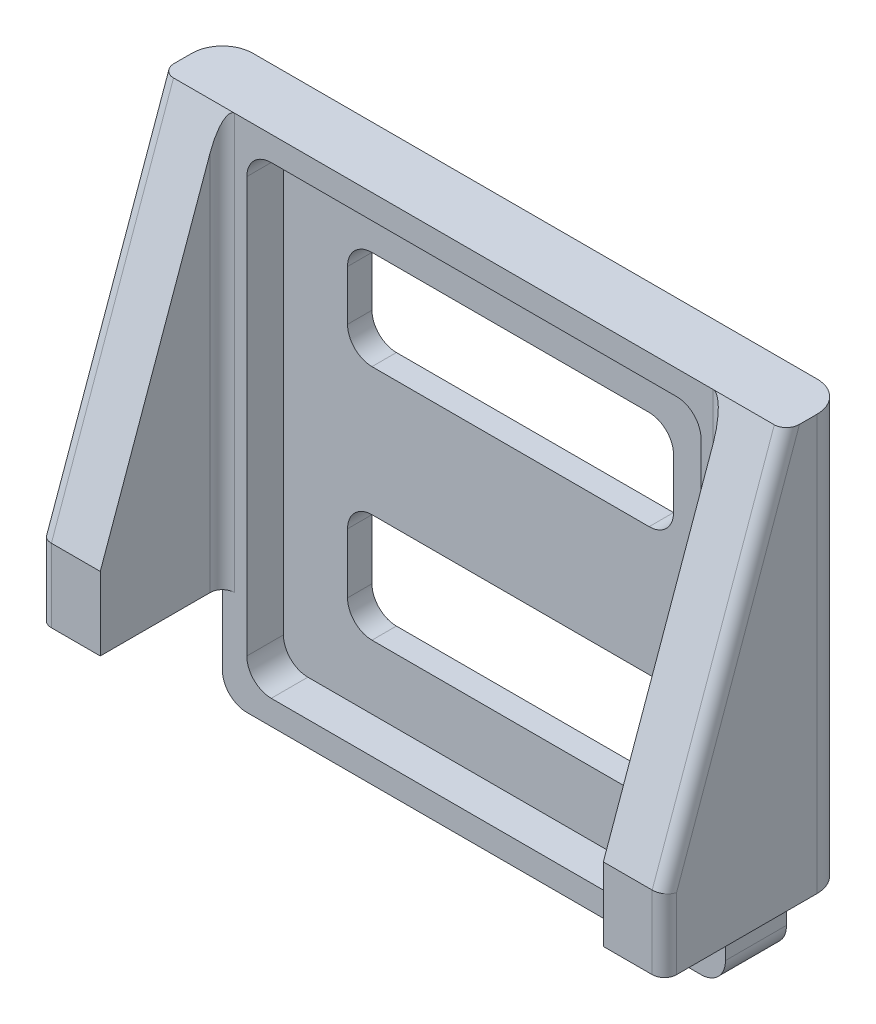
from build123d import *

# Parameters (mm, degrees)
SKETCH1_W           = 41.2
SKETCH1_H           = 42
BOSS_EXTRUDE1_DEPTH = 5
CUT_EXTRUDE1_DEPTH  = 3
CUT_EXTRUDE2_DEPTH  = 2
SKETCH6_W           = 5
SKETCH6_H           = 6
BOSS_EXTRUDE2_DEPTH = 5
SKETCH7_W           = 5
SKETCH7_H           = 6
BOSS_EXTRUDE3_DEPTH = 5
SKETCH13_W          = 5
SKETCH13_H          = 6
BOSS_EXTRUDE6_DEPTH = 10
SKETCH10_R          = 1.5
CUT_EXTRUDE3_DEPTH  = 6
FILLET4_R           = 2.5
BOSS_EXTRUDE7_DEPTH = 28
BOSS_EXTRUDE8_DEPTH = 5
FILLET10_R          = 1
FILLET12_R          = 2
FILLET13_R          = 1
FILLET14_R          = 1


with BuildPart() as part:
    # Sketch1 → Boss-Extrude1 (new body)
    with BuildSketch(Plane.XY):
        with Locations((20.6, -21)):
            Rectangle(SKETCH1_W, SKETCH1_H)
    extrude(amount=BOSS_EXTRUDE1_DEPTH)

    # Sketch2 → Cut-Extrude1 (cut)
    with BuildSketch(Plane.XY.offset(5)):
        with BuildLine():
            Line((4, -2), (37.2, -2))
            ThreePointArc((37.2, -2), (38.614213562, -2.585786438), (39.2, -4))
            Line((39.2, -4), (39.2, -38))
            ThreePointArc((39.2, -38), (38.614213562, -39.414213562), (37.2, -40))
            Line((37.2, -40), (4, -40))
            ThreePointArc((4, -40), (2.585786438, -39.414213562), (2, -38))
            Line((2, -38), (2, -4))
            ThreePointArc((2, -4), (2.585786438, -2.585786438), (4, -2))
        make_face()
    extrude(amount=-CUT_EXTRUDE1_DEPTH, mode=Mode.SUBTRACT)

    # Sketch3 → Cut-Extrude2 (cut)
    with BuildSketch(Plane.XY.offset(2)):
        with BuildLine():
            Line((9.25, -7.25), (31.95, -7.25))
            ThreePointArc((31.95, -7.25), (33.364213562, -7.835786438), (33.95, -9.25))
            Line((33.95, -9.25), (33.95, -13.35))
            ThreePointArc((33.95, -13.35), (33.364213562, -14.764213562), (31.95, -15.35))
            Line((31.95, -15.35), (9.25, -15.35))
            ThreePointArc((9.25, -15.35), (7.835786438, -14.764213562), (7.25, -13.35))
            Line((7.25, -13.35), (7.25, -9.25))
            ThreePointArc((7.25, -9.25), (7.835786438, -7.835786438), (9.25, -7.25))
        make_face()
        with BuildLine():
            Line((9.25, -25.85), (31.95, -25.85))
            ThreePointArc((31.95, -25.85), (33.364213562, -26.435786438), (33.95, -27.85))
            Line((33.95, -27.85), (33.95, -32.75))
            ThreePointArc((33.95, -32.75), (33.364213562, -34.164213562), (31.95, -34.75))
            Line((31.95, -34.75), (9.25, -34.75))
            ThreePointArc((9.25, -34.75), (7.835786438, -34.164213562), (7.25, -32.75))
            Line((7.25, -32.75), (7.25, -27.85))
            ThreePointArc((7.25, -27.85), (7.835786438, -26.435786438), (9.25, -25.85))
        make_face()
    extrude(amount=-CUT_EXTRUDE2_DEPTH, mode=Mode.SUBTRACT)

    # Sketch6 → Boss-Extrude2 (add)
    with BuildSketch(Plane(origin=(41.2, 0, 0), x_dir=(0, 0, -1), z_dir=(1, 0, 0))):
        with Locations((-2.5, -31)):
            Rectangle(SKETCH6_W, SKETCH6_H)
    extrude(amount=BOSS_EXTRUDE2_DEPTH)

    # Sketch7 → Boss-Extrude3 (add)
    with BuildSketch(Plane.ZY):
        with Locations((2.5, -31)):
            Rectangle(SKETCH7_W, SKETCH7_H)
    extrude(amount=BOSS_EXTRUDE3_DEPTH)

    # Sketch13 → Boss-Extrude6 (add)
    with BuildSketch(Plane.XY.offset(5)):
        with Locations((43.7, -31)):
            Rectangle(SKETCH13_W, SKETCH13_H)
        with Locations((-2.5, -31)):
            Rectangle(SKETCH13_W, SKETCH13_H)
    extrude(amount=BOSS_EXTRUDE6_DEPTH)

    # Sketch10 → Cut-Extrude3 (cut)
    with BuildSketch(Plane(origin=(0, -28, 0), x_dir=(1, 0, 0), z_dir=(0, 1, 0))):
        with Locations(Location((43.7, -3, 0), (0, 0, 180))):
            Circle(SKETCH10_R)
        with Locations(Location((43.7, -12, 0), (0, 0, 180))):
            Circle(SKETCH10_R)
    cut_extrude3 = extrude(amount=-CUT_EXTRUDE3_DEPTH, mode=Mode.SUBTRACT)

    # Mirror1: Cut-Extrude3 across plane
    add(cut_extrude3.mirror(Plane(origin=(20.6, 0, 0), x_dir=(0, 0, 1), z_dir=(1, 0, 0))), mode=Mode.SUBTRACT)

    # Fillet4
    fillet4_edges = [part.edges().sort_by_distance(p)[0] for p in [
        (-5, -31, 0),
        (46.2, -31, 0),
    ]]
    fillet(fillet4_edges, radius=FILLET4_R)

    # Sketch16 → Boss-Extrude7 (add)
    with BuildSketch(Plane(origin=(0, -28, 0), x_dir=(1, 0, 0), z_dir=(0, 1, 0))):
        with BuildLine():
            Line((41.2, 0), (43.7, 0))
            ThreePointArc((43.7, 0), (45.467766953, -0.732233047), (46.2, -2.5))
            Line((46.2, -2.5), (46.2, -5))
            Line((46.2, -5), (41.2, -5))
            Line((41.2, -5), (41.2, 0))
        make_face()
    boss_extrude7 = extrude(amount=BOSS_EXTRUDE7_DEPTH)

    # Sketch17 → Boss-Extrude8 (add)
    with BuildSketch(Plane(origin=(46.2, 0, 0), x_dir=(0, 0, -1), z_dir=(1, 0, 0))):
        Polygon((-5, 0), (-15, -28), (-5, -28), align=None)
    boss_extrude8 = extrude(amount=-BOSS_EXTRUDE8_DEPTH)

    # Fillet10
    fillet10_edges = [part.edges().sort_by_distance(p)[0] for p in [
        (46.2, -31, 15),
        (46.2, -14, 10),
    ]]
    fillet(fillet10_edges, radius=FILLET10_R)

    # Mirror3: Boss-Extrude7, Boss-Extrude8 across plane
    add(boss_extrude7.mirror(Plane(origin=(20.6, 0, 0), x_dir=(0, 0, 1), z_dir=(1, 0, 0))))
    add(boss_extrude8.mirror(Plane(origin=(20.6, 0, 0), x_dir=(0, 0, 1), z_dir=(1, 0, 0))))

    # Fillet12
    fillet12_edges = [part.edges().sort_by_distance(p)[0] for p in [
        (41.2, -42, 2.5),
        (0, -42, 2.5),
    ]]
    fillet(fillet12_edges, radius=FILLET12_R)

    # Fillet13
    fillet13_edges = [part.edges().sort_by_distance(p)[0] for p in [
        (-5, -31, 15),
        (-5, -14, 10),
    ]]
    fillet(fillet13_edges, radius=FILLET13_R)

    # Fillet14
    fillet14_edges = [part.edges().sort_by_distance(p)[0] for p in [
        (41.2, -17, 5),
        (0, -17, 5),
    ]]
    fillet(fillet14_edges, radius=FILLET14_R)


solid = part.part
